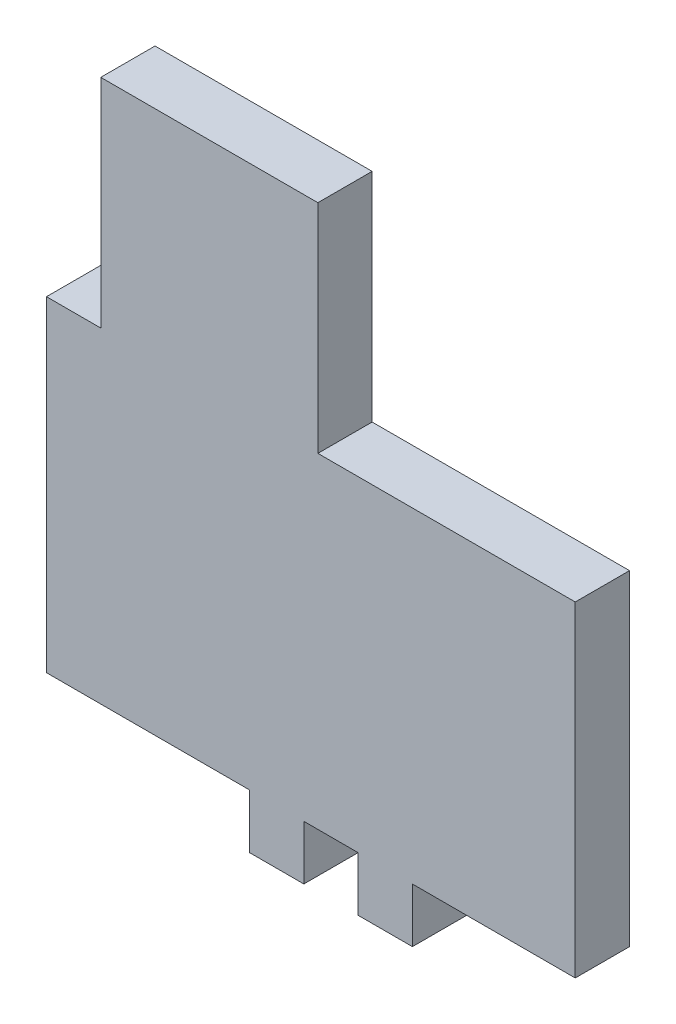
from build123d import *

# Parameters (mm, degrees)
BOSS_EXTRU_1_DEPTH = 5


with BuildPart() as part:
    # Esquisse1 → Boss.-Extru.1 (new body)
    with BuildSketch(Plane.XY):
        Polygon((-76.651818028, 2.670222797), (-71.651818028, 2.670222797), (-71.651818028, 22.670222797), (-51.651818028, 22.670222797), (-51.651818028, 2.670222797), (-27.941818028, 2.670222797), (-27.941818028, -27.329777203), (-42.941818028, -27.329777203), (-42.941818028, -32.329777203), (-47.941818028, -32.329777203), (-47.941818028, -27.329777203), (-52.941818028, -27.329777203), (-52.941818028, -32.329777203), (-57.941818028, -32.329777203), (-57.941818028, -27.329777203), (-76.651818028, -27.329777203), align=None)
    extrude(amount=BOSS_EXTRU_1_DEPTH)


solid = part.part
